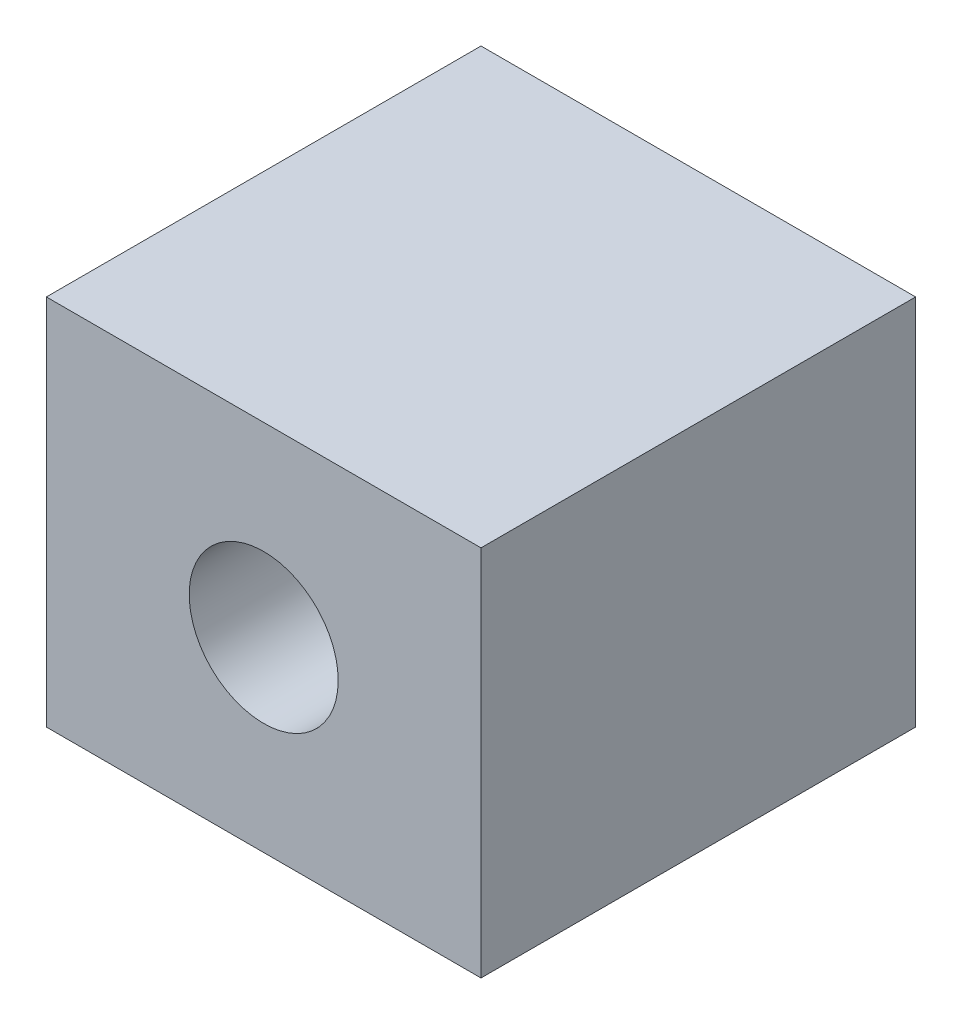
from build123d import *

# Parameters (mm, degrees)
SKETCH1_W           = 35
SKETCH1_H           = 30
SKETCH1_R           = 6
BOSS_EXTRUDE1_DEPTH = 35


with BuildPart() as part:
    # Sketch1 → Boss-Extrude1 (new body)
    with BuildSketch(Plane.XY):
        Rectangle(SKETCH1_W, SKETCH1_H)
        Circle(SKETCH1_R, mode=Mode.SUBTRACT)
    extrude(amount=BOSS_EXTRUDE1_DEPTH)


solid = part.part
